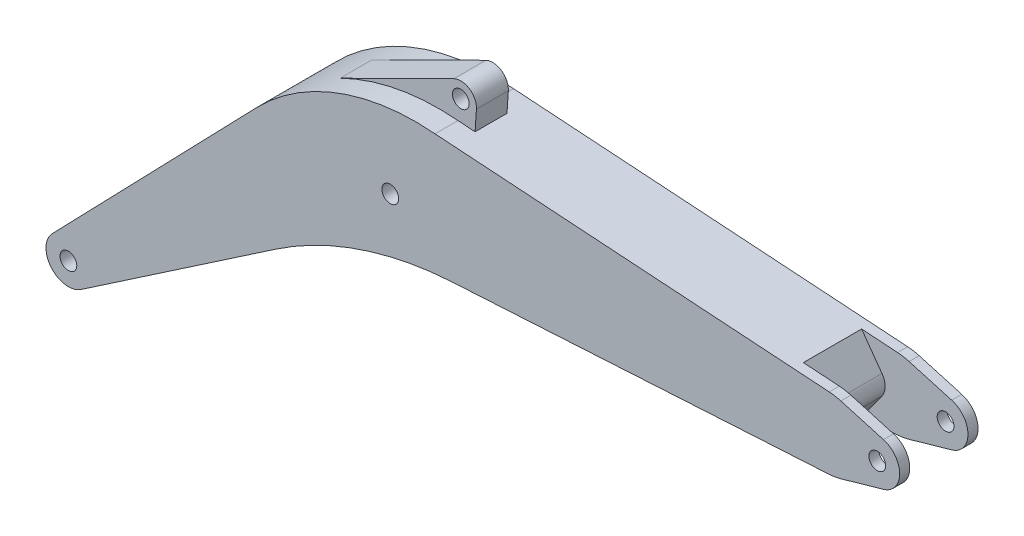
from build123d import *

# Parameters (mm, degrees)
EXTRUDE_1_DEPTH          = 7
EXTRUDE_1_DEPTH_BACK     = 7
SKETCH_1_R               = 1.5
FILLET_1_R               = 10
EXTRUDE_2_DEPTH          = 2.9
EXTRUDE_2_DEPTH_BACK     = 2.8
SKETCH_3_R               = 1.5
CUT_EXTRUDE_1_DEPTH      = 5.2
CUT_EXTRUDE_1_DEPTH_BACK = 5.2
SCALE1_SCALE             = 1.5


with BuildPart() as part:
    # 草图1 → 凸台-拉伸1 (new, two sides: drawn at the far end of the back side and taken through both)
    with BuildSketch(Plane.XY.offset(-EXTRUDE_1_DEPTH_BACK)):
        with BuildLine():
            ThreePointArc((132.1, 80.8), (147.125308547, 88.283437456), (163.6, 91.5))
            Line((163.6, 91.5), (232.071936087, 95.488208898))
            Line((232.071936087, 95.488208898), (240.699236038, 97.954004663))
            ThreePointArc((240.699236038, 97.954004663), (243.6, 101.8), (240.699236038, 105.645995337))
            Line((240.699236038, 105.645995337), (232.071936087, 108.111791102))
            Line((232.071936087, 108.111791102), (160.6, 112.9))
            ThreePointArc((160.6, 112.9), (143.303490983, 110.55954938), (128.7, 101))
            Line((128.7, 101), (92.224555949, 63.280615311))
            ThreePointArc((92.224555949, 63.280615311), (92.03920173, 57.924827394), (97.347754748, 57.19128445))
            Line((97.347754748, 57.19128445), (132.1, 80.8))
        make_face()
        with Locations((95.1, 60.5)):
            Circle(SKETCH_1_R, mode=Mode.SUBTRACT)
        with Locations((152.6, 99.603139307)):
            Circle(SKETCH_1_R, mode=Mode.SUBTRACT)
        with Locations((239.6, 101.8)):
            Circle(SKETCH_1_R, mode=Mode.SUBTRACT)
    extrude(amount=EXTRUDE_1_DEPTH + EXTRUDE_1_DEPTH_BACK)

    # 圆角1
    fillet_1_edges = [part.edges().sort_by_distance(p)[0] for p in [
        (232.071936087, 95.488208898, 0),
        (232.071936087, 108.111791102, 0),
    ]]
    fillet(fillet_1_edges, radius=FILLET_1_R)

    # 草图3 → 凸台-拉伸2 (add, two sides: drawn at the far end of the back side and taken through both)
    with BuildSketch(Plane.XY.offset(-EXTRUDE_2_DEPTH_BACK)):
        with BuildLine():
            Line((160.6, 112.9), (163.651401787, 112.69557362))
            Line((163.651401787, 112.69557362), (163.893737551, 116.312835642))
            ThreePointArc((163.893737551, 116.312835642), (162.654460758, 118.828873494), (159.855517856, 119.008239262))
            Line((159.855517856, 119.008239262), (139.549521827, 108.933263618))
            ThreePointArc((139.549521827, 108.933263618), (149.801009446, 112.369362402), (160.6, 112.9))
        make_face()
        with Locations((161.1, 116.5)):
            Circle(SKETCH_3_R, mode=Mode.SUBTRACT)
    extrude(amount=EXTRUDE_2_DEPTH + EXTRUDE_2_DEPTH_BACK)

    # 草图4 → 切除-拉伸1 (cut, two sides: drawn at the far end of the back side and taken through both)
    with BuildSketch(Plane.XY.offset(-CUT_EXTRUDE_1_DEPTH_BACK)):
        with BuildLine():
            Line((231.012866709, 108.182742662), (224.6, 108.612367871))
            Line((224.6, 108.612367871), (228.236474469, 103.550312019))
            ThreePointArc((228.236474469, 103.550312019), (228.799985675, 101.790729145), (228.225610058, 100.034662683))
            Line((228.225610058, 100.034662683), (224.6, 95.052999327))
            Line((224.6, 95.052999327), (230.968280992, 95.423925524))
            ThreePointArc((230.968280992, 95.423925524), (232.061731819, 95.548272011), (233.134897693, 95.792017302))
            Line((233.134897693, 95.792017302), (240.699236038, 97.954004663))
            ThreePointArc((240.699236038, 97.954004663), (243.6, 101.8), (240.699236038, 105.645995337))
            Line((240.699236038, 105.645995337), (233.092512669, 107.820096895))
            ThreePointArc((233.092512669, 107.820096895), (232.062285935, 108.056450871), (231.012866709, 108.182742662))
        make_face()
    extrude(amount=CUT_EXTRUDE_1_DEPTH + CUT_EXTRUDE_1_DEPTH_BACK, mode=Mode.SUBTRACT)


with BuildPart() as part_1:
    # Scale1: scaled about (160.287784575, 95.185568028, 0.00047642)
    add(part.part.scale(SCALE1_SCALE).moved(Location((-80.143892287, -47.592784014, -0.00023821))))


solid = part_1.part
